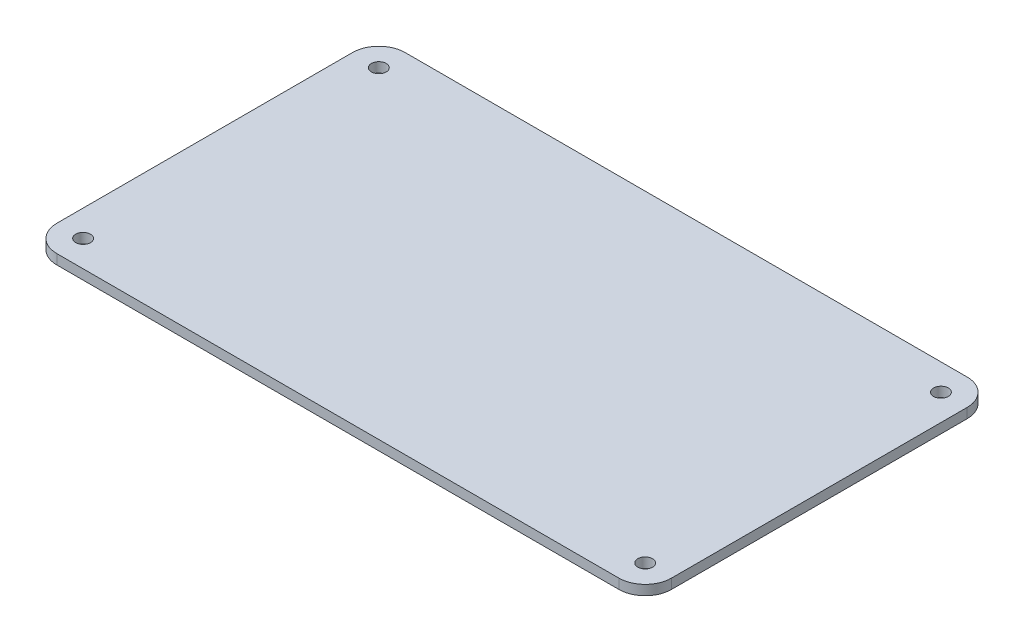
from build123d import *

# Parameters (mm, degrees)
BOSS_EXTRUDE1_DEPTH     = 4.7625
F_1_4_CLEARANCE_HOLE1_D = 7.14248


with BuildPart() as part:
    # Sketch2 → Boss-Extrude1 (new body)
    with BuildSketch(Plane(origin=(0, 0, 0), x_dir=(1, 0, 0), z_dir=(0, 1, 0))):
        with BuildLine():
            Line((-12.7, 0), (-12.7, -142.88262))
            ThreePointArc((-12.7, -142.88262), (-8.980256121, -151.862876121), (0, -155.58262))
            Line((0, -155.58262), (271.58696, -155.58262))
            ThreePointArc((271.58696, -155.58262), (280.567216121, -151.862876121), (284.28696, -142.88262))
            Line((284.28696, -142.88262), (284.28696, 0))
            ThreePointArc((284.28696, 0), (280.567216121, 8.980256121), (271.58696, 12.7))
            Line((271.58696, 12.7), (0, 12.7))
            ThreePointArc((0, 12.7), (-8.980256121, 8.980256121), (-12.7, 0))
        make_face()
    extrude(amount=BOSS_EXTRUDE1_DEPTH)

    # 1/4 Clearance Hole1 (through all)
    with Locations(Plane(origin=(0, 4.7625, 0), x_dir=(1, 0, 0), z_dir=(0, 1, 0))):
        with Locations((0, 0), (0, -142.88262), (271.58696, -142.88262), (271.58696, 0)):
            Hole(F_1_4_CLEARANCE_HOLE1_D / 2)


solid = part.part
